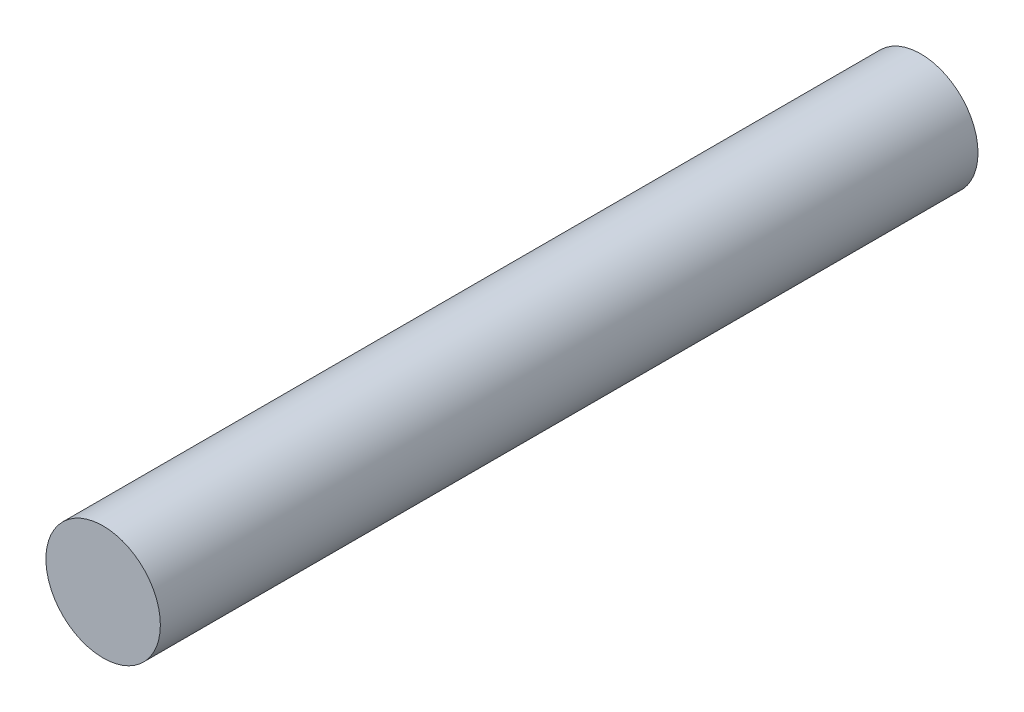
from build123d import *

# Parameters (mm, degrees)
SKETCH1_R           = 2.8
BOSS_EXTRUDE1_DEPTH = 40


with BuildPart() as part:
    # Sketch1 → Boss-Extrude1 (new body)
    with BuildSketch(Plane.XY):
        Circle(SKETCH1_R)
    extrude(amount=BOSS_EXTRUDE1_DEPTH)


solid = part.part
